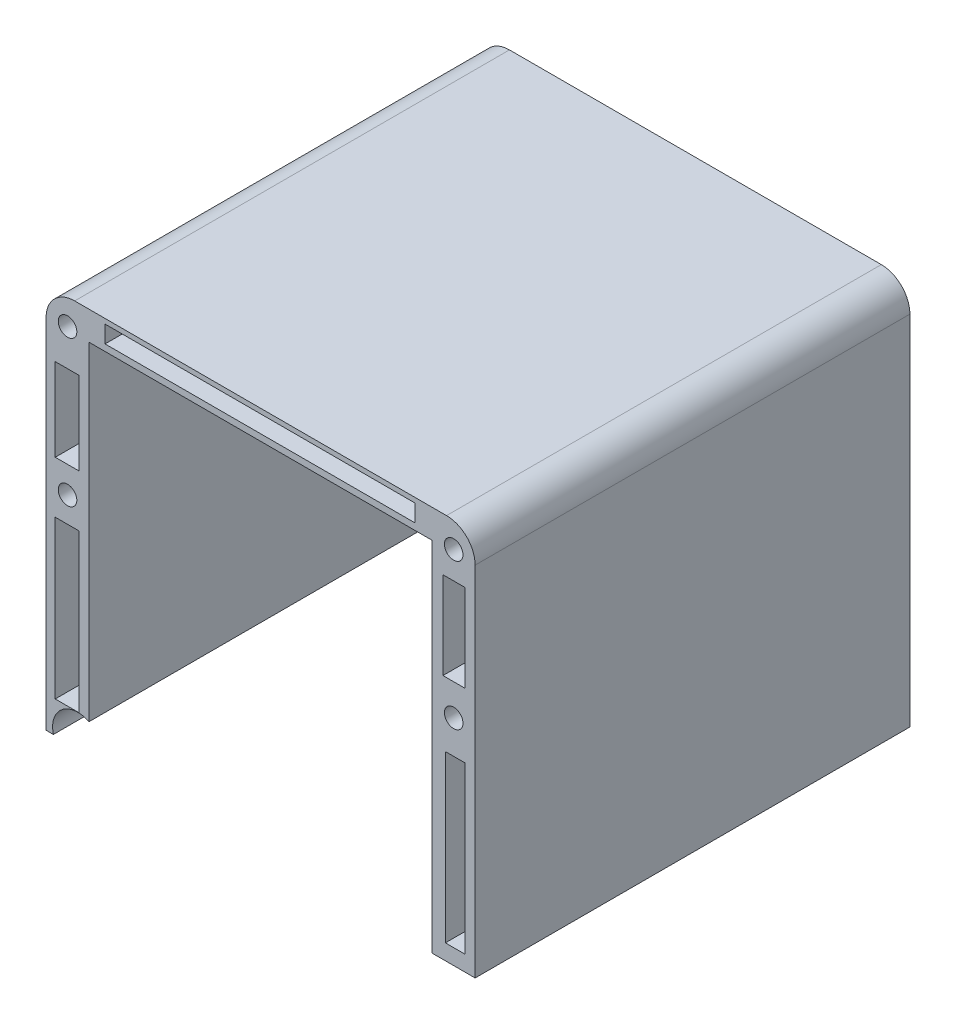
from build123d import *

# Parameters (mm, degrees)
SKETCH2_W           = 120
SKETCH2_H           = 115
BOSS_EXTRUDE1_DEPTH = 152
SKETCH3_W           = 120
SKETCH3_H           = 13.389184999
CUT_EXTRUDE1_DEPTH  = 192.155706765
SKETCH5_R           = 3.25
CUT_EXTRUDE2_DEPTH  = 30
SKETCH6_W           = 4.5
SKETCH6_H           = 90
SKETCH6_W_2         = 106.706999447
SKETCH6_H_2         = 3.032111459
CUT_EXTRUDE4_DEPTH  = 130
SKETCH7_R           = 3.25
CUT_EXTRUDE5_DEPTH  = 15
SKETCH8_W           = 8.291807731
SKETCH8_H           = 28.961241497
SKETCH8_H_2         = 55.038375958
SKETCH8_W_2         = 108.394356143
SKETCH8_H_3         = 6.008556327
SKETCH8_W_3         = 7.690952099
SKETCH8_H_4         = 30.523466142
SKETCH8_W_4         = 6.849754213
SKETCH8_H_5         = 57.922482994
CUT_EXTRUDE6_DEPTH  = 150
CUT_EXTRUDE7_DEPTH  = 192.155706765


with BuildPart() as part:
    # Sketch2 → Boss-Extrude1 (new body)
    with BuildSketch(Plane.XY):
        with BuildLine():
            Line((-48.334664537, 64.049520767), (81.665335463, 64.049520767))
            ThreePointArc((81.665335463, 64.049520767), (88.736403275, 61.120588579), (91.665335463, 54.049520767))
            Line((91.665335463, 54.049520767), (91.665335463, -70.950479233))
            Line((91.665335463, -70.950479233), (-58.334664537, -70.950479233))
            Line((-58.334664537, -70.950479233), (-58.334664537, 54.049520767))
            ThreePointArc((-58.334664537, 54.049520767), (-55.405732349, 61.120588579), (-48.334664537, 64.049520767))
        make_face()
        with Locations((16.665335463, -3.450479233)):
            Rectangle(SKETCH2_W, SKETCH2_H, mode=Mode.SUBTRACT)
    extrude(amount=BOSS_EXTRUDE1_DEPTH)

    # Sketch3 → Cut-Extrude1 (cut, through all)
    with BuildSketch(Plane.XY.offset(152)):
        with Locations((16.665335463, -67.645071732)):
            Rectangle(SKETCH3_W, SKETCH3_H)
    extrude(amount=-CUT_EXTRUDE1_DEPTH, mode=Mode.SUBTRACT)

    # Sketch5 → Cut-Extrude2 (cut)
    with BuildSketch(Plane(origin=(0, 0, 0), x_dir=(-1, 0, 0), z_dir=(0, 0, -1))):
        with Locations((-82.665335463, 56.549520767)):
            Circle(SKETCH5_R)
        with Locations((49.334664537, 56.549520767)):
            Circle(SKETCH5_R)
    extrude(amount=-CUT_EXTRUDE2_DEPTH, mode=Mode.SUBTRACT)

    # Sketch6 → Cut-Extrude4 (cut)
    with BuildSketch(Plane(origin=(0, 0, 0), x_dir=(-1, 0, 0), z_dir=(0, 0, -1))):
        with Locations((50.834664537, -0.950479233)):
            Rectangle(SKETCH6_W, SKETCH6_H)
        with Locations((-84.165335463, -0.950479233)):
            Rectangle(SKETCH6_W, SKETCH6_H)
        with Locations((-16.665335464, 59.14514242)):
            Rectangle(SKETCH6_W_2, SKETCH6_H_2)
    extrude(amount=-CUT_EXTRUDE4_DEPTH, mode=Mode.SUBTRACT)

    # Sketch7 → Cut-Extrude5 (cut)
    with BuildSketch(Plane.XY.offset(152)):
        with Locations((-50.834664537, 55.049520767)):
            Circle(SKETCH7_R)
        with Locations((-50.834664537, 4.049520767)):
            Circle(SKETCH7_R)
        with Locations((84.165335463, 4.049520767)):
            Circle(SKETCH7_R)
        with Locations((84.165335463, 55.049520767)):
            Circle(SKETCH7_R)
    extrude(amount=-CUT_EXTRUDE5_DEPTH, mode=Mode.SUBTRACT)

    # Sketch8 → Cut-Extrude6 (cut)
    with BuildSketch(Plane.XY.offset(152)):
        with Locations((-50.991008781, 27.795371112)):
            Rectangle(SKETCH8_W, SKETCH8_H)
        with Locations((-50.991008781, -32.350277723)):
            Rectangle(SKETCH8_W, SKETCH8_H_2)
        with Locations((16.485078773, 59.340291831)):
            Rectangle(SKETCH8_W_2, SKETCH8_H_3)
        with Locations((84.261594145, 30.258879207)):
            Rectangle(SKETCH8_W_3, SKETCH8_H_4)
        with Locations((84.682193087, -36.556267152)):
            Rectangle(SKETCH8_W_4, SKETCH8_H_5)
    extrude(amount=-CUT_EXTRUDE6_DEPTH, mode=Mode.SUBTRACT)

    # Sketch9 → Cut-Extrude7 (cut, through all)
    with BuildSketch(Plane.XY.offset(152)):
        with BuildLine():
            Line((-55.78242584, -70.950479233), (-43.00561738, -70.950479233))
            Line((-43.00561738, -70.950479233), (-43.00561738, -60.861864812))
            Line((-43.00561738, -60.861864812), (-43.334664537, -60.861864812))
            ThreePointArc((-43.334664537, -60.861864812), (-52.78845028, -61.92097783), (-55.78242584, -70.950479233))
        make_face()
    extrude(amount=-CUT_EXTRUDE7_DEPTH, mode=Mode.SUBTRACT)


solid = part.part
